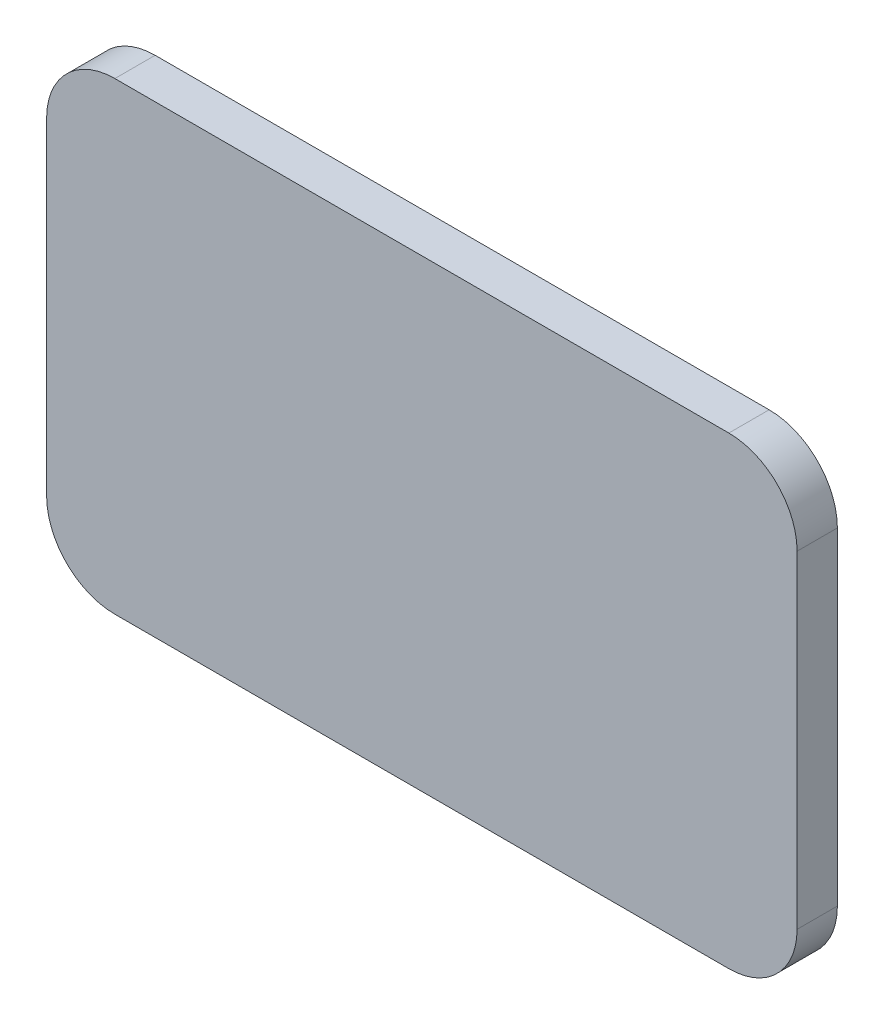
from build123d import *

# Parameters (mm, degrees)
SALIENTE_EXTRUIR1_DEPTH = 1.5


with BuildPart() as part:
    # Croquis2 → Saliente-Extruir1 (new body)
    with BuildSketch(Plane.XY):
        with BuildLine():
            Line((2.54, 0), (25.4, 0))
            ThreePointArc((25.4, 0), (27.196051224, 0.743948776), (27.94, 2.54))
            Line((27.94, 2.54), (27.94, 14.732))
            ThreePointArc((27.94, 14.732), (27.196051224, 16.528051224), (25.4, 17.272))
            Line((25.4, 17.272), (2.54, 17.272))
            ThreePointArc((2.54, 17.272), (0.743948776, 16.528051224), (0, 14.732))
            Line((0, 14.732), (0, 2.54))
            ThreePointArc((0, 2.54), (0.743948776, 0.743948776), (2.54, 0))
        make_face()
    extrude(amount=-SALIENTE_EXTRUIR1_DEPTH)


solid = part.part
